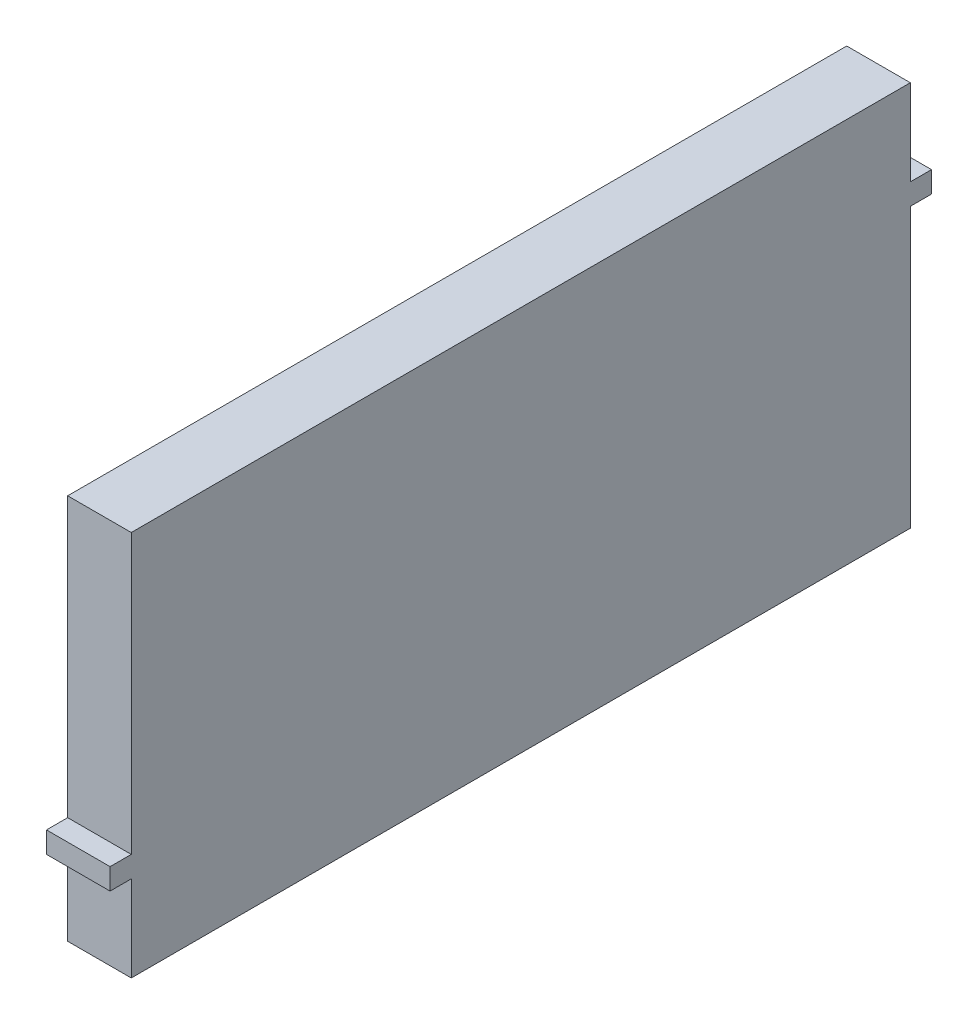
from build123d import *

# Parameters (mm, degrees)
BOSS_EXTRUDE1_DEPTH = 9.525


with BuildPart() as part:
    # Sketch1 → Boss-Extrude1 (new body)
    with BuildSketch(Plane(origin=(243.017706631, 0, 0), x_dir=(0, 0, -1), z_dir=(1, 0, 0))):
        Polygon((-319.681194078, 406.659208455), (-322.856194078, 406.659208455), (-322.856194078, 419.517958455), (-439.537444078, 419.517958455), (-439.537444078, 377.766708455), (-442.712444078, 377.766708455), (-442.712444078, 374.591708455), (-439.537444078, 374.591708455), (-439.537444078, 361.732958455), (-322.856194078, 361.732958455), (-322.856194078, 403.484208455), (-319.681194078, 403.484208455), align=None)
    extrude(amount=BOSS_EXTRUDE1_DEPTH)


solid = part.part
